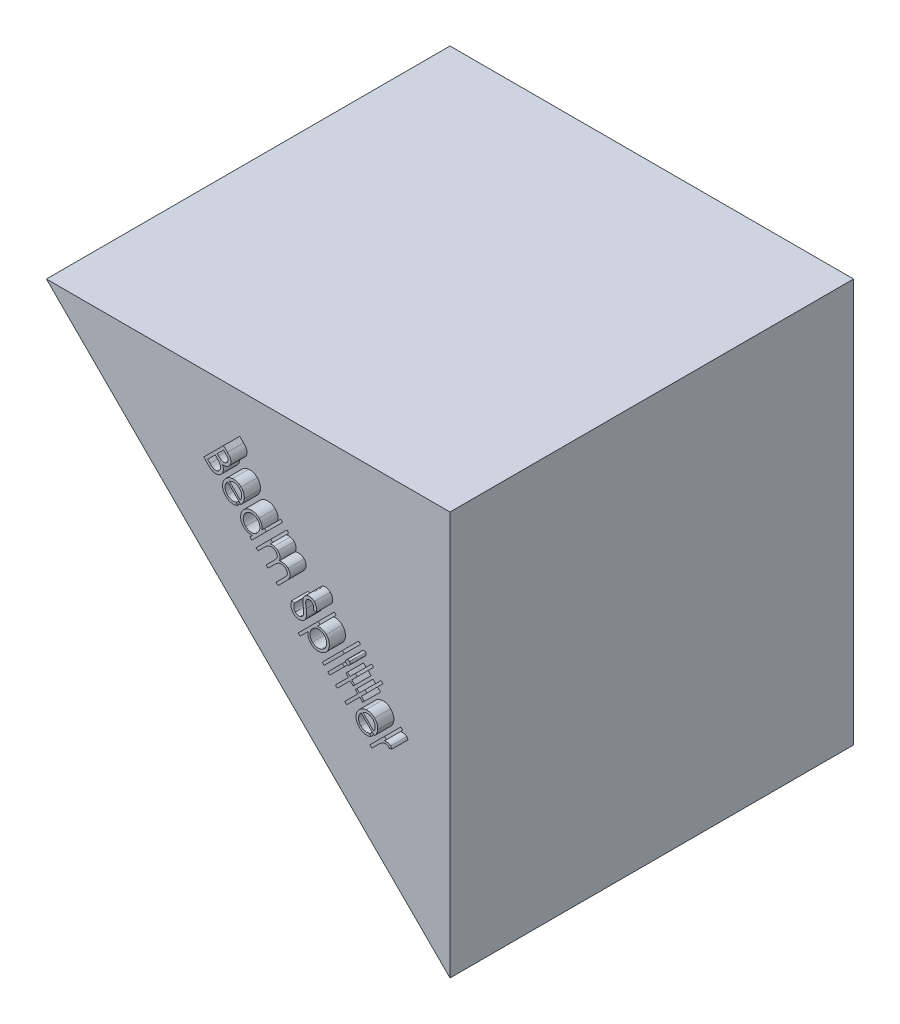
from build123d import *

# Parameters (mm, degrees)
BOSS_EXTRUDE1_DEPTH = 50
BOSS_EXTRUDE2_DEPTH = 2


with BuildPart() as part:
    # Sketch2 → Boss-Extrude1 (new body)
    with BuildSketch(Plane.XY):
        Polygon((-25, 25), (25, -25), (25, 25), align=None)
    extrude(amount=BOSS_EXTRUDE1_DEPTH)

    # Sketch4 → Boss-Extrude2 (add)
    # profile 1 of 13: a face of its own
    with BuildSketch(Plane.XY.offset(50)):
        with BuildLine():
            Line((18.890578005, -1.125044946), (19.128258294, -1.362725234))
            Line((19.128258294, -1.362725234), (18.863234255, -1.627749273))
            add(Edge.make_bspline(
                [(18.863234255, -1.627749273), (18.905664435, -1.620401977), (18.987348258, -1.606257442), (19.106904055, -1.59873747), (19.218017822, -1.60174019), (19.32096047, -1.61610099), (19.415681068, -1.642138184), (19.502125705, -1.678470317), (19.57996789, -1.726396122), (19.624294117, -1.766777124), (19.6463873, -1.78690392)],
                knots=[0, 0, 0, 0, 1.241211544, 2.389499754, 3.448301135, 4.442547987, 5.37958009, 6.273508928, 7.139478203, 8, 8, 8, 8], degree=3))
            add(Edge.make_bspline(
                [(19.6463873, -1.78690392), (19.662152608, -1.804220792), (19.694494667, -1.839745838), (19.733320617, -1.903409749), (19.766712399, -1.975665868), (19.783017204, -2.02809425), (19.791519512, -2.055433567)],
                knots=[0, 0, 0, 0, 0.909455834, 1.865721482, 2.887058557, 4, 4, 4, 4], degree=3))
            Line((19.791519512, -2.055433567), (19.473210217, -2.131154721))
            add(Edge.make_bspline(
                [(19.473210217, -2.131154721), (19.466555373, -2.114391022), (19.454029462, -2.082837977), (19.43088527, -2.040644022), (19.408766181, -2.004119642), (19.390560325, -1.984610033), (19.382064383, -1.975505683)],
                knots=[0, 0, 0, 0, 1.190511604, 2.240810163, 3.179056851, 4, 4, 4, 4], degree=3))
            add(Edge.make_bspline(
                [(19.382064383, -1.975505683), (19.361487844, -1.957252748), (19.319961236, -1.920415529), (19.242939965, -1.881688383), (19.155649222, -1.857054288), (19.076227397, -1.84678532), (19.008521153, -1.845645335), (18.954799236, -1.850077575), (18.8994629, -1.859217375), (18.842339218, -1.873512495), (18.783534201, -1.892441294), (18.72317027, -1.916450482), (18.661185703, -1.945349501), (18.620067076, -1.967575768), (18.598911339, -1.979011292)],
                knots=[0, 0, 0, 0, 1.174416853, 2.370153105, 3.65340849, 5.046895083, 5.787918235, 6.551267354, 7.35292589, 8.188329261, 9.071795005, 9.997759325, 10.969837261, 12, 12, 12, 12], degree=3))
            add(Edge.make_bspline(
                [(18.598911339, -1.979011292), (18.580750275, -1.989979104), (18.540648018, -2.014197621), (18.478853582, -2.059916247), (18.407558846, -2.115239723), (18.328756348, -2.183188785), (18.240427504, -2.261239246), (18.144509135, -2.351673329), (18.039270606, -2.452333636), (17.967075154, -2.524121443), (17.929340025, -2.561643503)],
                knots=[0, 0, 0, 0, 0.57221484, 1.263533197, 2.072177219, 3.007245432, 4.070389439, 5.252780822, 6.564083091, 8, 8, 8, 8], degree=3))
            Line((17.929340025, -2.561643503), (17.316559576, -3.174423952))
            Line((17.316559576, -3.174423952), (17.078879287, -2.936743664))
            Line((17.078879287, -2.936743664), (18.890578005, -1.125044946))
        make_face()
    # profile 2 of 13: a face of its own
    with BuildSketch(Plane.XY.offset(50)):
        with BuildLine():
            Line((17.071981385, -1.728123005), (17.165230584, -2.027502011))
            add(Edge.make_bspline(
                [(17.165230584, -2.027502011), (17.118711193, -2.041901978), (17.028205522, -2.069917795), (16.892426285, -2.096804509), (16.762286376, -2.112415759), (16.637048425, -2.113666211), (16.516149008, -2.103095526), (16.398812854, -2.081241325), (16.284241529, -2.048723912), (16.172453652, -2.005378834), (16.063575506, -1.94924204), (15.95722764, -1.880727317), (15.853365101, -1.799356685), (15.788421287, -1.737339845), (15.755274654, -1.705687107)],
                knots=[0, 0, 0, 0, 1.14337475, 2.224489593, 3.246783556, 4.218691023, 5.161197887, 6.093800951, 7.018450246, 7.955487584, 8.905814629, 9.891229908, 10.923706128, 12, 12, 12, 12], degree=3))
            add(Edge.make_bspline(
                [(15.755274654, -1.705687107), (15.720178574, -1.668943254), (15.651774541, -1.597327629), (15.563721244, -1.481286998), (15.49032384, -1.362527882), (15.431489228, -1.240745167), (15.388141362, -1.115610655), (15.360890775, -0.987234979), (15.348178663, -0.855993437), (15.350538838, -0.723172466), (15.366530019, -0.591989592), (15.391232176, -0.464457914), (15.427490786, -0.342615465), (15.47283715, -0.22574705), (15.529205319, -0.114431552), (15.596262482, -0.009095736), (15.672815108, 0.091288211), (15.730866366, 0.152781665), (15.760182507, 0.18383613)],
                knots=[0, 0, 0, 0, 1.153505557, 2.248240613, 3.301726212, 4.320405292, 5.314324999, 6.302485689, 7.294560466, 8.303383573, 9.313546827, 10.293286028, 11.250809265, 12.197244869, 13.137450858, 14.080066925, 15.030425349, 16, 16, 16, 16], degree=3))
            add(Edge.make_bspline(
                [(15.760182507, 0.18383613), (15.789132661, 0.211744951), (15.846272923, 0.266829886), (15.939881983, 0.338924884), (16.036925398, 0.403273981), (16.13837374, 0.458678652), (16.244264398, 0.504540357), (16.354384703, 0.540894595), (16.468474685, 0.569461985), (16.546715232, 0.580648431), (16.586103981, 0.58628004)],
                knots=[0, 0, 0, 0, 1.029832415, 2.03262798, 3.022679286, 4.011661158, 4.990782401, 5.975657052, 6.980882167, 8, 8, 8, 8], degree=3))
            add(Edge.make_bspline(
                [(16.586103981, 0.58628004), (16.636071744, 0.590935278), (16.734523258, 0.600107496), (16.880900802, 0.593871816), (17.022229831, 0.572596917), (17.158324054, 0.533438125), (17.288970421, 0.477640426), (17.414893157, 0.406099904), (17.535835833, 0.318104233), (17.609327633, 0.248280434), (17.646901257, 0.212582123)],
                knots=[0, 0, 0, 0, 1.030798262, 2.030982423, 3.003462981, 3.96313366, 4.934141121, 5.917529137, 6.935310111, 8, 8, 8, 8], degree=3))
            add(Edge.make_bspline(
                [(17.646901257, 0.212582123), (17.683551428, 0.173847359), (17.755283303, 0.09803551), (17.846008363, -0.026777432), (17.92122402, -0.155873212), (17.978321582, -0.290955458), (18.018797639, -0.43098807), (18.041627429, -0.576243315), (18.048591922, -0.726659124), (18.03933049, -0.827694237), (18.034621609, -0.879064511)],
                knots=[0, 0, 0, 0, 1.063807223, 2.082088108, 3.073002933, 4.041130971, 5.00261211, 5.976156965, 6.97099761, 8, 8, 8, 8], degree=3))
            add(Edge.make_bspline(
                [(18.034621609, -0.879064511), (18.029577594, -0.915913535), (18.019516078, -0.98941789), (17.990032367, -1.09719585), (17.953642266, -1.203468493), (17.904943099, -1.306948788), (17.847753351, -1.408756463), (17.779495203, -1.507859959), (17.70286847, -1.60570664), (17.644847644, -1.666876819), (17.615350776, -1.697974768)],
                knots=[0, 0, 0, 0, 0.951364535, 1.897728359, 2.855395875, 3.824641717, 4.821500491, 5.842285008, 6.90305193, 8, 8, 8, 8], degree=3))
            Line((17.615350776, -1.697974768), (15.986644846, -0.069268838))
            add(Edge.make_bspline(
                [(15.986644846, -0.069268838), (15.961863961, -0.096204935), (15.913337607, -0.148951658), (15.849850536, -0.233638437), (15.796685655, -0.320782415), (15.751811786, -0.409701231), (15.716651078, -0.501314216), (15.690614211, -0.595197421), (15.674244351, -0.691517019), (15.668313919, -0.789013114), (15.670902517, -0.885959786), (15.682749984, -0.980409179), (15.703977654, -1.07154383), (15.734004569, -1.159299754), (15.773742222, -1.24371479), (15.823031069, -1.324005729), (15.880869655, -1.401633939), (15.925830338, -1.448823052), (15.94878427, -1.472914671)],
                knots=[0, 0, 0, 0, 1.121678263, 2.196489528, 3.238606981, 4.248014423, 5.246040331, 6.242135197, 7.230468167, 8.23569606, 9.232100145, 10.199960908, 11.148965087, 12.096155113, 13.038535726, 14.003208359, 14.98057112, 16, 16, 16, 16], degree=3))
            add(Edge.make_bspline(
                [(15.94878427, -1.472914671), (15.972155339, -1.495428804), (16.018744531, -1.54030973), (16.096856023, -1.597781881), (16.178296297, -1.650571334), (16.264790169, -1.694672248), (16.352862618, -1.731650882), (16.441003399, -1.760179556), (16.528407522, -1.779017342), (16.617532897, -1.790396288), (16.713544707, -1.790838524), (16.820701988, -1.778702635), (16.942231129, -1.759743552), (17.02701231, -1.73908211), (17.071981385, -1.728123005)],
                knots=[0, 0, 0, 0, 0.960880005, 1.915471739, 2.868629679, 3.835285571, 4.788594539, 5.697766926, 6.576884551, 7.435260203, 8.356622716, 9.414693406, 10.628718719, 12, 12, 12, 12], degree=3))
        make_face()
        with BuildLine():
            add(Edge.make_bspline(
                [(17.559962154, -1.240142236), (17.581837284, -1.202477795), (17.623921088, -1.130018208), (17.671231049, -1.018418385), (17.706241003, -0.911675525), (17.724714732, -0.807102009), (17.729639265, -0.703932789), (17.721745967, -0.600115797), (17.700946624, -0.494811343), (17.668126369, -0.389368468), (17.624384162, -0.286002577), (17.569443962, -0.188164125), (17.504042505, -0.096641734), (17.452642633, -0.042071889), (17.426749013, -0.014581338)],
                knots=[0, 0, 0, 0, 1.169762225, 2.250411434, 3.251822014, 4.18348598, 5.095497708, 6.021595392, 6.975241018, 7.974777718, 8.98531032, 9.986661778, 10.985744273, 12, 12, 12, 12], degree=3))
            add(Edge.make_bspline(
                [(17.426749013, -0.014581338), (17.404518993, 0.006962693), (17.360716834, 0.049413172), (17.288321921, 0.103434425), (17.214841059, 0.152208436), (17.136869921, 0.191286044), (17.056469774, 0.223568087), (16.973033468, 0.248583378), (16.886464546, 0.264564648), (16.827579929, 0.269622981), (16.797842763, 0.272177476)],
                knots=[0, 0, 0, 0, 1.049137773, 2.067226999, 3.059075058, 4.037747443, 5.019786334, 5.995660531, 6.987793763, 8, 8, 8, 8], degree=3))
            add(Edge.make_bspline(
                [(16.797842763, 0.272177476), (16.775402521, 0.272789552), (16.729997414, 0.274028015), (16.660771645, 0.268824854), (16.589961711, 0.257560809), (16.51732966, 0.239801445), (16.443041463, 0.215592067), (16.36654386, 0.18632018), (16.288727107, 0.150389291), (16.237277064, 0.12286932), (16.211003821, 0.108816098)],
                knots=[0, 0, 0, 0, 0.872509664, 1.76541744, 2.694766804, 3.658024887, 4.669711852, 5.731315059, 6.841483737, 8, 8, 8, 8], degree=3))
            Line((16.211003821, 0.108816098), (17.559962154, -1.240142236))
        make_face(mode=Mode.SUBTRACT)
    # profile 3 of 13: a face of its own
    with BuildSketch(Plane.XY.offset(50)):
        Polygon((16.459601376, 2.652085529), (16.694477178, 2.417209728), (16.021400255, 1.744132805), (16.39089144, 1.374641619), (16.191071729, 1.174821908), (15.821580543, 1.544313093), (14.209701537, -0.067565913), (13.974825735, 0.167309888), (15.586704742, 1.779188895), (15.269096569, 2.096797068), (15.46891628, 2.296616779), (15.786524453, 1.979008606), align=None)
    # profile 4 of 13: a face of its own
    with BuildSketch(Plane.XY.offset(50)):
        Polygon((15.28562281, 3.826064096), (15.520498611, 3.591188294), (14.847421688, 2.918111371), (15.216912874, 2.548620185), (15.017093163, 2.348800474), (14.647601977, 2.71829166), (13.03572297, 1.106412653), (12.800847169, 1.341288455), (14.412726176, 2.953167461), (14.095118002, 3.270775634), (14.294937714, 3.470595346), (14.612545887, 3.152987173), align=None)
    # profile 5 of 13: a face of its own
    with BuildSketch(Plane.XY.offset(50)):
        with BuildLine():
            add(Edge.make_bspline(
                [(14.539204097, 4.718316142), (14.551486086, 4.704743497), (14.575590453, 4.678106114), (14.60111387, 4.630894067), (14.616201171, 4.579537319), (14.620638485, 4.525507649), (14.616201171, 4.471477979), (14.60111387, 4.420121231), (14.575590453, 4.372909183), (14.551486086, 4.346271801), (14.539204097, 4.332699155)],
                knots=[0, 0, 0, 0, 1.022162629, 2.006074404, 2.975076234, 4, 5.024923766, 5.993925596, 6.977837371, 8, 8, 8, 8], degree=3))
            add(Edge.make_bspline(
                [(14.539204097, 4.332699155), (14.52587289, 4.320621082), (14.499709363, 4.296916925), (14.452528346, 4.272215248), (14.401469576, 4.256232624), (14.347108857, 4.252094592), (14.292900616, 4.256100262), (14.242048575, 4.272553738), (14.194288612, 4.296824646), (14.167817809, 4.321029073), (14.154288231, 4.333400277)],
                knots=[0, 0, 0, 0, 1.006534559, 1.975402156, 2.963457113, 3.991243031, 5.019028948, 5.994540287, 6.97498293, 8, 8, 8, 8], degree=3))
            add(Edge.make_bspline(
                [(14.154288231, 4.333400277), (14.142230886, 4.346737502), (14.118567412, 4.37291284), (14.093599115, 4.419947576), (14.078841793, 4.47104628), (14.07426727, 4.525017552), (14.078557712, 4.57918829), (14.094496507, 4.630235865), (14.11920944, 4.677419757), (14.142912062, 4.703582892), (14.154989353, 4.716913899)],
                knots=[0, 0, 0, 0, 1.010873706, 1.983918069, 2.97246127, 3.991550813, 5.023767492, 6.016081931, 6.989126294, 8, 8, 8, 8], degree=3))
            add(Edge.make_bspline(
                [(14.154989353, 4.716913899), (14.16856196, 4.729195563), (14.195199267, 4.753299293), (14.242411862, 4.778827331), (14.293766536, 4.79389714), (14.347571055, 4.798383841), (14.401562156, 4.793750539), (14.452655749, 4.779008368), (14.499691806, 4.754036154), (14.525866964, 4.730373215), (14.539204097, 4.718316142)],
                knots=[0, 0, 0, 0, 1.026867049, 2.015307197, 2.988768778, 4.018409672, 5.034956187, 6.021032585, 6.991648821, 8, 8, 8, 8], degree=3))
        make_face()
    # profile 6 of 13: a face of its own
    with BuildSketch(Plane.XY.offset(50)):
        Polygon((13.676824289, 4.088708771), (13.91170009, 3.853832969), (12.100001372, 2.042134251), (11.865125571, 2.277010053), align=None)
    # profile 7 of 13: a face of its own
    with BuildSketch(Plane.XY.offset(50)):
        Polygon((13.678502531, 5.486469632), (13.911274967, 5.253697196), (11.399856697, 2.742278926), (11.167084261, 2.975051362), align=None)
    # profile 8 of 13: a face of its own
    with BuildSketch(Plane.XY.offset(50)):
        with BuildLine():
            Line((10.668686424, 7.096846636), (10.900056616, 6.865476443))
            Line((10.900056616, 6.865476443), (10.567023764, 6.532443591))
            add(Edge.make_bspline(
                [(10.567023764, 6.532443591), (10.620681884, 6.539122605), (10.725388527, 6.552155809), (10.880753165, 6.553344849), (11.029089772, 6.535213059), (11.17120582, 6.502200965), (11.30600044, 6.449918492), (11.434926946, 6.382528864), (11.556190061, 6.296372157), (11.629279818, 6.227873141), (11.666382738, 6.193100642)],
                knots=[0, 0, 0, 0, 1.083185549, 2.11369165, 3.104292222, 4.072264151, 5.030039122, 5.993865542, 6.981615906, 8, 8, 8, 8], degree=3))
            add(Edge.make_bspline(
                [(11.666382738, 6.193100642), (11.697202238, 6.160734497), (11.758082117, 6.096799422), (11.836805334, 5.99167801), (11.902720604, 5.881208495), (11.957548942, 5.765890729), (11.999511696, 5.645275468), (12.02900851, 5.519301961), (12.046670257, 5.388295519), (12.051068225, 5.25354174), (12.044349234, 5.118871565), (12.025734262, 4.987480584), (11.993636918, 4.861590656), (11.951080358, 4.740096806), (11.895286085, 4.623758125), (11.826778019, 4.513118713), (11.747455037, 4.406564592), (11.685791002, 4.341991572), (11.654463667, 4.309186379)],
                knots=[0, 0, 0, 0, 1.023687358, 2.02216012, 3.002361287, 3.968008255, 4.943793914, 5.923453385, 6.928742326, 7.968601011, 9.009163092, 10.015935139, 11.004603497, 11.982166559, 12.962089595, 13.95520286, 14.961176584, 16, 16, 16, 16], degree=3))
            add(Edge.make_bspline(
                [(11.654463667, 4.309186379), (11.620924866, 4.27720339), (11.555026018, 4.214361488), (11.447278433, 4.132598308), (11.335141714, 4.062926245), (11.217847165, 4.005792198), (11.096272938, 3.960613431), (10.969572471, 3.928337959), (10.838339607, 3.907898082), (10.70381587, 3.90070772), (10.569789572, 3.904397055), (10.439158342, 3.921212028), (10.313974545, 3.95074404), (10.19393461, 3.992362879), (10.079082191, 4.045988904), (9.969188144, 4.111440159), (9.864480307, 4.189628871), (9.800802135, 4.250308851), (9.768446039, 4.281141508)],
                knots=[0, 0, 0, 0, 1.058993912, 2.080768382, 3.086216623, 4.073262574, 5.058976791, 6.046601197, 7.057840905, 8.090872257, 9.122728099, 10.119619421, 11.096939972, 12.058545789, 13.019616919, 13.990149676, 14.978756678, 16, 16, 16, 16], degree=3))
            add(Edge.make_bspline(
                [(9.768446039, 4.281141508), (9.734083686, 4.317511178), (9.666191493, 4.389369376), (9.581924244, 4.50957601), (9.51121027, 4.635365698), (9.457050564, 4.768451034), (9.419340066, 4.908647495), (9.395986896, 5.055012994), (9.389030542, 5.208351758), (9.39606125, 5.312053974), (9.399655975, 5.365075802)],
                knots=[0, 0, 0, 0, 1.011926893, 1.999337382, 2.963153277, 3.928883982, 4.900048302, 5.896623414, 6.924566155, 8, 8, 8, 8], degree=3))
            Line((9.399655975, 5.365075802), (8.425797802, 4.391217629))
            Line((8.425797802, 4.391217629), (8.19442761, 4.622587822))
            Line((8.19442761, 4.622587822), (10.668686424, 7.096846636))
        make_face()
        with BuildLine():
            add(Edge.make_bspline(
                [(11.423093475, 5.986269713), (11.397536019, 6.010302888), (11.347318, 6.057525837), (11.266453972, 6.120033673), (11.180675564, 6.170908158), (11.092520766, 6.21454345), (10.999569265, 6.246607477), (10.903580673, 6.269872079), (10.803711575, 6.283302881), (10.701606017, 6.286253849), (10.599144561, 6.281434888), (10.498991693, 6.264671236), (10.401849674, 6.239735906), (10.308053816, 6.204468416), (10.217991857, 6.158959786), (10.130404471, 6.105026055), (10.046819595, 6.040019322), (9.994751295, 5.990915027), (9.968265751, 5.965937181)],
                knots=[0, 0, 0, 0, 1.036646365, 2.036913527, 3.013062686, 3.980052609, 4.939115033, 5.912523019, 6.89529748, 7.911301824, 8.92822154, 9.921883995, 10.907034596, 11.888521605, 12.877056782, 13.885306063, 14.924320175, 16, 16, 16, 16], degree=3))
            add(Edge.make_bspline(
                [(9.968265751, 5.965937181), (9.935479923, 5.93124469), (9.871259361, 5.863289376), (9.793321582, 5.748624938), (9.730711687, 5.628839267), (9.685666916, 5.503128521), (9.658885992, 5.373541779), (9.650427165, 5.241636837), (9.660325462, 5.108047021), (9.689399837, 4.97502969), (9.734372025, 4.846390532), (9.794922427, 4.725748868), (9.86866202, 4.613859926), (9.929438075, 4.548650246), (9.959852289, 4.516017309)],
                knots=[0, 0, 0, 0, 1.060829248, 2.077942044, 3.073577278, 4.062300803, 5.03950691, 6.008930819, 6.994640103, 8.010688473, 9.03056358, 10.019122929, 11.008707932, 12, 12, 12, 12], degree=3))
            add(Edge.make_bspline(
                [(9.959852289, 4.516017309), (9.992033638, 4.486316757), (10.055984656, 4.427295597), (10.165558805, 4.355766031), (10.283748943, 4.298296821), (10.410119096, 4.256617251), (10.54206825, 4.231006767), (10.676508868, 4.224347721), (10.812401793, 4.234664489), (10.947115402, 4.264709408), (11.078101394, 4.309320655), (11.200168768, 4.370272088), (11.312687272, 4.444658188), (11.378283498, 4.505261389), (11.411174405, 4.535648719)],
                knots=[0, 0, 0, 0, 0.978521325, 1.944524937, 2.915188779, 3.912411463, 4.913452708, 5.913687659, 6.915630091, 7.953689836, 8.993973496, 10.00432885, 10.999341322, 12, 12, 12, 12], degree=3))
            add(Edge.make_bspline(
                [(11.411174405, 4.535648719), (11.442128095, 4.568698423), (11.50366421, 4.634401425), (11.577493283, 4.747866264), (11.638942193, 4.869049344), (11.682826921, 4.999039303), (11.71206003, 5.132615374), (11.722434, 5.267254601), (11.71607285, 5.400660763), (11.689147892, 5.531221058), (11.647676625, 5.657607628), (11.588951754, 5.776570215), (11.514892005, 5.88791155), (11.45397876, 5.953177463), (11.423093475, 5.986269713)],
                knots=[0, 0, 0, 0, 1.009635128, 2.007160496, 3.01098977, 4.037792448, 5.062642737, 6.057542242, 7.045515651, 8.035472889, 9.025911708, 10.008755554, 10.990364872, 12, 12, 12, 12], degree=3))
        make_face(mode=Mode.SUBTRACT)
    # profile 9 of 13: a face of its own
    with BuildSketch(Plane.XY.offset(50)):
        with BuildLine():
            Line((7.381994993, 7.673001208), (7.715027845, 7.589567714))
            add(Edge.make_bspline(
                [(7.715027845, 7.589567714), (7.701278549, 7.53952679), (7.674960449, 7.443741377), (7.65124976, 7.302635925), (7.640198894, 7.172088217), (7.645525196, 7.051642242), (7.6653842, 6.941610915), (7.70074081, 6.842134094), (7.7504518, 6.752282776), (7.795564367, 6.702345841), (7.818092749, 6.677408259)],
                knots=[0, 0, 0, 0, 1.291176079, 2.471493815, 3.556724466, 4.546898705, 5.46435486, 6.329279941, 7.165673282, 8, 8, 8, 8], degree=3))
            add(Edge.make_bspline(
                [(7.818092749, 6.677408259), (7.839092362, 6.657635934), (7.880557313, 6.618594333), (7.951377016, 6.57082359), (8.026522685, 6.531287306), (8.106094715, 6.501225311), (8.187593121, 6.481690364), (8.268964148, 6.472661221), (8.348732154, 6.47659935), (8.426183242, 6.490363352), (8.499600351, 6.515093566), (8.568246603, 6.548472685), (8.632129774, 6.589418749), (8.669026871, 6.623767681), (8.687483775, 6.640949926)],
                knots=[0, 0, 0, 0, 1.07119194, 2.115130436, 3.164842574, 4.223869745, 5.269543681, 6.274544611, 7.257695498, 8.229484564, 9.191506659, 10.128383898, 11.063768104, 12, 12, 12, 12], degree=3))
            add(Edge.make_bspline(
                [(8.687483775, 6.640949926), (8.707002995, 6.662532501), (8.746252257, 6.705930757), (8.791041169, 6.783837721), (8.826009035, 6.870418529), (8.839172974, 6.932808789), (8.8459373, 6.964868195)],
                knots=[0, 0, 0, 0, 0.951552025, 1.913381446, 2.927785344, 4, 4, 4, 4], degree=3))
            add(Edge.make_bspline(
                [(8.8459373, 6.964868195), (8.849496649, 6.989374731), (8.856965451, 7.040798311), (8.862752722, 7.122530285), (8.865652013, 7.212109506), (8.86403562, 7.309894218), (8.858088041, 7.415549654), (8.84913553, 7.52920821), (8.835500599, 7.650719594), (8.82435809, 7.734252757), (8.81859355, 7.777468356)],
                knots=[0, 0, 0, 0, 0.728237508, 1.528105792, 2.408504073, 3.364194011, 4.403737984, 5.52102854, 6.71751255, 8, 8, 8, 8], degree=3))
            add(Edge.make_bspline(
                [(8.81859355, 7.777468356), (8.812898343, 7.820459333), (8.802010432, 7.90264808), (8.78778724, 8.020398907), (8.777096885, 8.126982874), (8.770165889, 8.222150119), (8.765754197, 8.30607439), (8.764097672, 8.378552015), (8.765483085, 8.440211648), (8.770184234, 8.477210035), (8.772319512, 8.49401483)],
                knots=[0, 0, 0, 0, 1.446124113, 2.764652865, 3.954996913, 5.017754494, 5.946341782, 6.757000529, 7.435425373, 8, 8, 8, 8], degree=3))
            add(Edge.make_bspline(
                [(8.772319512, 8.49401483), (8.776365267, 8.518867606), (8.784329174, 8.567789303), (8.802947928, 8.638980776), (8.825878744, 8.707051675), (8.854048667, 8.771765993), (8.887088602, 8.833406376), (8.926075972, 8.891259068), (8.968421335, 8.947238216), (9.000777362, 8.981121493), (9.017011018, 8.9981214)],
                knots=[0, 0, 0, 0, 1.058992889, 2.084585255, 3.092151245, 4.078670416, 5.051071046, 6.030210775, 7.011717962, 8, 8, 8, 8], degree=3))
            add(Edge.make_bspline(
                [(9.017011018, 8.9981214), (9.043931158, 9.023456194), (9.096991897, 9.073392149), (9.187283213, 9.133858218), (9.283225858, 9.181356988), (9.384547952, 9.214707608), (9.488857555, 9.235740958), (9.595333906, 9.240016424), (9.70255434, 9.231468064), (9.808866461, 9.205810594), (9.913268004, 9.169665227), (10.011551601, 9.118364095), (10.104449496, 9.055916134), (10.158874598, 9.004547265), (10.186482172, 8.97848999)],
                knots=[0, 0, 0, 0, 1.018758265, 2.008015852, 2.985853666, 3.964860698, 4.94391022, 5.91242938, 6.896374234, 7.902394438, 8.922397369, 9.937781271, 10.953922823, 12, 12, 12, 12], degree=3))
            add(Edge.make_bspline(
                [(10.186482172, 8.97848999), (10.214033884, 8.949083087), (10.268706303, 8.890729307), (10.334437783, 8.790320137), (10.387413837, 8.682992186), (10.420776546, 8.587280088), (10.439110006, 8.505402044), (10.449756954, 8.438689065), (10.455662203, 8.366751881), (10.458595436, 8.290010577), (10.456977243, 8.208104987), (10.451250857, 8.121093227), (10.441367563, 8.028976381), (10.432307409, 7.966043769), (10.427668069, 7.933818516)],
                knots=[0, 0, 0, 0, 1.295470664, 2.570675635, 3.846147014, 5.14310301, 5.822196153, 6.545934075, 7.316473173, 8.144777815, 9.017815504, 9.952863946, 10.95174417, 12, 12, 12, 12], degree=3))
            Line((10.427668069, 7.933818516), (10.07640605, 7.98219592))
            add(Edge.make_bspline(
                [(10.07640605, 7.98219592), (10.079737097, 8.008128171), (10.086152259, 8.058070302), (10.094479364, 8.1304564), (10.098201395, 8.197869193), (10.100819322, 8.260058333), (10.099794569, 8.317122575), (10.097688204, 8.369172019), (10.091151535, 8.415969281), (10.080087937, 8.471223538), (10.060146007, 8.534895658), (10.025970753, 8.605819066), (9.982353959, 8.671760932), (9.946554376, 8.710648088), (9.928469352, 8.730292875)],
                knots=[0, 0, 0, 0, 1.184266723, 2.280743053, 3.298905822, 4.241524397, 5.098991591, 5.883440502, 6.599019358, 7.23633328, 8.434848111, 9.60899535, 10.792126177, 12, 12, 12, 12], degree=3))
            add(Edge.make_bspline(
                [(9.928469352, 8.730292875), (9.903799252, 8.753081154), (9.856064435, 8.797174788), (9.77288109, 8.844449733), (9.686018363, 8.875396913), (9.596058636, 8.884971343), (9.507707437, 8.879316092), (9.423725773, 8.855807732), (9.3460493, 8.814402456), (9.302316895, 8.775000649), (9.279931691, 8.754832138)],
                knots=[0, 0, 0, 0, 1.108390795, 2.144654212, 3.142766654, 4.139709309, 5.116888158, 6.0572744, 7.005581559, 8, 8, 8, 8], degree=3))
            add(Edge.make_bspline(
                [(9.279931691, 8.754832138), (9.266896791, 8.741387023), (9.240884171, 8.714555772), (9.20930386, 8.668160634), (9.180492732, 8.619615276), (9.157260141, 8.56618618), (9.138504934, 8.506865737), (9.12650899, 8.439495028), (9.118811659, 8.363785699), (9.117801787, 8.310342621), (9.117271435, 8.282276048)],
                knots=[0, 0, 0, 0, 0.872206552, 1.740587019, 2.610335877, 3.503892006, 4.452388294, 5.506808572, 6.690656621, 8, 8, 8, 8], degree=3))
            add(Edge.make_bspline(
                [(9.117271435, 8.282276048), (9.11766627, 8.272455717), (9.118617112, 8.248806379), (9.122479576, 8.207681657), (9.127924084, 8.154811244), (9.136849409, 8.090657753), (9.146422741, 8.014643361), (9.158185532, 7.927176038), (9.173424477, 7.828226406), (9.183475716, 7.758313894), (9.188785858, 7.721378612)],
                knots=[0, 0, 0, 0, 0.416963678, 1.004132585, 1.752086881, 2.672130089, 3.75206962, 5.003039264, 6.416684121, 8, 8, 8, 8], degree=3))
            add(Edge.make_bspline(
                [(9.188785858, 7.721378612), (9.195065541, 7.676534109), (9.207215081, 7.589771754), (9.221543059, 7.463333304), (9.23052287, 7.344751371), (9.235809404, 7.233926892), (9.236020387, 7.130731741), (9.231054004, 7.035512627), (9.222454602, 6.948081529), (9.203813155, 6.843978852), (9.171127616, 6.724972971), (9.116056636, 6.59492175), (9.04638003, 6.478570206), (8.986825101, 6.413143017), (8.957415666, 6.38083374)],
                knots=[0, 0, 0, 0, 1.154073635, 2.232829841, 3.242441131, 4.184480987, 5.060076888, 5.871224333, 6.613870166, 7.297408356, 8.56479994, 9.749711327, 10.888761692, 12, 12, 12, 12], degree=3))
            add(Edge.make_bspline(
                [(8.957415666, 6.38083374), (8.934927306, 6.359558024), (8.890456735, 6.317485449), (8.81713282, 6.263254595), (8.739367618, 6.218586389), (8.658377089, 6.180410506), (8.572372829, 6.153145621), (8.482703672, 6.13204113), (8.388625686, 6.121400699), (8.29176829, 6.118676088), (8.194574221, 6.123945689), (8.099414179, 6.13861653), (8.007931334, 6.162731358), (7.919673915, 6.194912012), (7.834992519, 6.236787674), (7.753787392, 6.287287181), (7.675736044, 6.346615092), (7.627909977, 6.392047458), (7.60354948, 6.415188708)],
                knots=[0, 0, 0, 0, 0.987419472, 1.952614886, 2.901856038, 3.846337881, 4.803981627, 5.775639995, 6.782227406, 7.819438665, 8.865383083, 9.88443968, 10.886706716, 11.880192648, 12.877590837, 13.895937461, 14.928283006, 16, 16, 16, 16], degree=3))
            add(Edge.make_bspline(
                [(7.60354948, 6.415188708), (7.585494675, 6.433855291), (7.549643756, 6.470920998), (7.501332752, 6.530868763), (7.457931937, 6.592928458), (7.419849701, 6.657548852), (7.385797292, 6.723965134), (7.35804605, 6.793617027), (7.334828701, 6.865283739), (7.316312193, 6.939463257), (7.303540768, 7.017045751), (7.297588708, 7.098672234), (7.297009293, 7.184380493), (7.301846878, 7.274330681), (7.313465081, 7.368369641), (7.330353188, 7.466387877), (7.352750919, 7.568716106), (7.372058816, 7.637568551), (7.381994993, 7.673001208)],
                knots=[0, 0, 0, 0, 0.923509253, 1.833786328, 2.735632435, 3.615439222, 4.500416779, 5.388202063, 6.279562127, 7.178951928, 8.105711734, 9.073093024, 10.087496873, 11.153343944, 12.275401901, 13.456413066, 14.691026271, 16, 16, 16, 16], degree=3))
        make_face()
    # profile 10 of 13: a face of its own
    with BuildSketch(Plane.XY.offset(50)):
        with BuildLine():
            Line((4.79388574, 12.971647319), (5.025255933, 12.740277127))
            Line((5.025255933, 12.740277127), (4.712555612, 12.427576806))
            add(Edge.make_bspline(
                [(4.712555612, 12.427576806), (4.759905069, 12.434978702), (4.850524659, 12.449144794), (4.982402155, 12.455961531), (5.103705938, 12.452004447), (5.179617702, 12.437381937), (5.215961061, 12.430381294)],
                knots=[0, 0, 0, 0, 1.134473677, 2.171208445, 3.124451552, 4, 4, 4, 4], degree=3))
            add(Edge.make_bspline(
                [(5.215961061, 12.430381294), (5.261756847, 12.417388421), (5.351780167, 12.391847611), (5.477428084, 12.332256139), (5.593265291, 12.258764653), (5.659931545, 12.197059403), (5.693425003, 12.166058377)],
                knots=[0, 0, 0, 0, 1.032654138, 2.029945562, 3.010234824, 4, 4, 4, 4], degree=3))
            add(Edge.make_bspline(
                [(5.693425003, 12.166058377), (5.7144928, 12.143819732), (5.756505828, 12.099471818), (5.810210476, 12.025703813), (5.855498144, 11.947053844), (5.892114203, 11.864900595), (5.921111965, 11.781263906), (5.940189862, 11.697562159), (5.949535659, 11.615000223), (5.948906241, 11.532343935), (5.937226617, 11.446827944), (5.913061499, 11.356231699), (5.879023501, 11.258282627), (5.847876975, 11.192852938), (5.831545997, 11.158546358)],
                knots=[0, 0, 0, 0, 1.00533737, 2.004826032, 2.988358455, 3.981311445, 4.95472706, 5.891402496, 6.795035451, 7.67782268, 8.599500702, 9.621607202, 10.752943411, 12, 12, 12, 12], degree=3))
            add(Edge.make_bspline(
                [(5.831545997, 11.158546358), (5.858819348, 11.166059648), (5.912343443, 11.180804519), (5.992788063, 11.198043182), (6.071823065, 11.208669277), (6.149456, 11.216429525), (6.225841102, 11.217413081), (6.300857679, 11.214414631), (6.374292319, 11.20467613), (6.469760657, 11.187526386), (6.584274698, 11.153729777), (6.712806893, 11.09550584), (6.831709581, 11.02074447), (6.900049929, 10.95708165), (6.93441058, 10.9250728)],
                knots=[0, 0, 0, 0, 0.859045316, 1.685880955, 2.495883023, 3.279812829, 4.053556047, 4.813802993, 5.557673419, 6.301035794, 7.758555751, 9.168861684, 10.576539933, 12, 12, 12, 12], degree=3))
            add(Edge.make_bspline(
                [(6.93441058, 10.9250728), (6.963882665, 10.893373635), (7.02142026, 10.831488169), (7.090257755, 10.726709743), (7.14142995, 10.615627002), (7.174192545, 10.498689875), (7.190015962, 10.378925034), (7.186406233, 10.257729589), (7.163242164, 10.136887612), (7.129224821, 10.036600975), (7.091444545, 9.95526987), (7.054536992, 9.8909426), (7.010794327, 9.823292587), (6.95937738, 9.75251615), (6.900491634, 9.678517243), (6.834466527, 9.601205464), (6.760565194, 9.521214414), (6.7078704, 9.467757232), (6.68060449, 9.440096839)],
                knots=[0, 0, 0, 0, 1.209733365, 2.361731451, 3.491510003, 4.620000237, 5.74773195, 6.860184626, 7.998113719, 9.179214519, 9.814231796, 10.505477689, 11.252986731, 12.068123698, 12.952781798, 13.899218811, 14.912991071, 16, 16, 16, 16], degree=3))
            Line((6.68060449, 9.440096839), (5.691321638, 8.450813986))
            Line((5.691321638, 8.450813986), (5.453641349, 8.688494274))
            Line((5.453641349, 8.688494274), (6.442924202, 9.677777127))
            add(Edge.make_bspline(
                [(6.442924202, 9.677777127), (6.466122923, 9.701319861), (6.510555334, 9.746411158), (6.573302811, 9.81205115), (6.627995235, 9.874206904), (6.676605092, 9.931357174), (6.717855547, 9.984570488), (6.752632932, 10.032972623), (6.780301285, 10.077108464), (6.807393546, 10.12997769), (6.83024335, 10.195265654), (6.846561628, 10.274596214), (6.84709398, 10.356360311), (6.836718971, 10.438741873), (6.814010729, 10.521308913), (6.775458286, 10.600272539), (6.726009656, 10.677300284), (6.683052811, 10.722402945), (6.66097308, 10.745585621)],
                knots=[0, 0, 0, 0, 1.264308701, 2.421525023, 3.47275104, 4.430787231, 5.290892379, 6.047435303, 6.709808252, 7.281521255, 8.316428011, 9.345565774, 10.364833074, 11.42819055, 12.514927032, 13.622603783, 14.778023183, 16, 16, 16, 16], degree=3))
            add(Edge.make_bspline(
                [(6.66097308, 10.745585621), (6.632147761, 10.772391972), (6.575133673, 10.825412707), (6.474614908, 10.885566288), (6.36648438, 10.931503655), (6.250247445, 10.958367513), (6.1309415, 10.971050596), (6.011057003, 10.964383174), (5.892522273, 10.940101959), (5.794621422, 10.904994319), (5.715150977, 10.864829305), (5.649540117, 10.826103183), (5.57991585, 10.777227394), (5.504641564, 10.720136187), (5.424130916, 10.654515612), (5.339634787, 10.578747377), (5.248655149, 10.495856472), (5.188367312, 10.435483822), (5.15706683, 10.404139306)],
                knots=[0, 0, 0, 0, 1.07879147, 2.133759908, 3.19862743, 4.294988807, 5.398359592, 6.485013952, 7.579286357, 8.712627368, 9.329994089, 10.023738666, 10.80383394, 11.665515132, 12.619194427, 13.656309143, 14.783193149, 16, 16, 16, 16], degree=3))
            Line((5.15706683, 10.404139306), (4.447531574, 9.69460405))
            Line((4.447531574, 9.69460405), (4.216161381, 9.925974242))
            Line((4.216161381, 9.925974242), (5.143745516, 10.853558377))
            add(Edge.make_bspline(
                [(5.143745516, 10.853558377), (5.169763874, 10.879892233), (5.219832037, 10.930567522), (5.290420598, 11.004447533), (5.352993862, 11.073049921), (5.40722799, 11.136614967), (5.454237872, 11.194230373), (5.493191147, 11.247049189), (5.524152504, 11.29454661), (5.555199228, 11.350125845), (5.581404541, 11.418252458), (5.601530947, 11.500789292), (5.604797001, 11.58570315), (5.596973769, 11.671159975), (5.574071905, 11.755600308), (5.538222329, 11.837025823), (5.487452291, 11.913848029), (5.445211543, 11.959561585), (5.423493112, 11.983065589)],
                knots=[0, 0, 0, 0, 1.330253238, 2.559859307, 3.671624332, 4.666336319, 5.56214849, 6.34322225, 7.023421132, 7.598495632, 8.627775355, 9.636183871, 10.636834068, 11.666353592, 12.709349255, 13.765849434, 14.851292963, 16, 16, 16, 16], degree=3))
            add(Edge.make_bspline(
                [(5.423493112, 11.983065589), (5.395694755, 12.008270037), (5.340325579, 12.058472628), (5.243995568, 12.118056741), (5.137700302, 12.161366608), (5.023900084, 12.189895939), (4.905912347, 12.202423139), (4.786539817, 12.198598403), (4.668042238, 12.175495443), (4.570328967, 12.14200921), (4.491414732, 12.104846125), (4.428275274, 12.068776403), (4.361937235, 12.024946566), (4.291423488, 11.974678395), (4.218972108, 11.91521686), (4.14254457, 11.849278363), (4.062146503, 11.776312864), (4.00889674, 11.723626039), (3.98128558, 11.696306774)],
                knots=[0, 0, 0, 0, 1.083894396, 2.158916845, 3.256307527, 4.392703367, 5.541800114, 6.678397068, 7.834691665, 9.021364541, 9.656516682, 10.355927896, 11.122923385, 11.956054792, 12.859926905, 13.833085992, 14.876407946, 16, 16, 16, 16], degree=3))
            Line((3.98128558, 11.696306774), (3.213557215, 10.928578409))
            Line((3.213557215, 10.928578409), (2.982187022, 11.159948601))
            Line((2.982187022, 11.159948601), (4.79388574, 12.971647319))
        make_face()
    # profile 11 of 13: a face of its own
    with BuildSketch(Plane.XY.offset(50)):
        with BuildLine():
            Line((4.252719473, 13.512813586), (2.441020755, 11.701114868))
            Line((2.441020755, 11.701114868), (2.211052807, 11.931082817))
            Line((2.211052807, 11.931082817), (2.522350884, 12.242380894))
            add(Edge.make_bspline(
                [(2.522350884, 12.242380894), (2.469328066, 12.238782256), (2.365623917, 12.231743895), (2.212299026, 12.23875515), (2.065599016, 12.261954414), (1.925316582, 12.300506754), (1.791830022, 12.354822267), (1.665330158, 12.425048966), (1.54547466, 12.510415629), (1.473428856, 12.578274776), (1.437014345, 12.612573202)],
                knots=[0, 0, 0, 0, 1.073728533, 2.100041269, 3.095036115, 4.070467267, 5.034666616, 6.001085814, 6.989677717, 8, 8, 8, 8], degree=3))
            add(Edge.make_bspline(
                [(1.437014345, 12.612573202), (1.406426122, 12.644947361), (1.346122461, 12.708771936), (1.268349695, 12.813417247), (1.201394352, 12.922566618), (1.1482872, 13.03780669), (1.107481917, 13.158229598), (1.077735688, 13.283270792), (1.060986242, 13.413920459), (1.057273235, 13.547943597), (1.064490136, 13.682460786), (1.084849984, 13.813722218), (1.117391542, 13.940239651), (1.16147159, 14.062130886), (1.218861681, 14.179245881), (1.288454038, 14.29141188), (1.370238814, 14.399151531), (1.433077742, 14.465051472), (1.465059217, 14.49859083)],
                knots=[0, 0, 0, 0, 1.01790845, 2.006772542, 2.975731241, 3.94189944, 4.90201605, 5.879590755, 6.876741322, 7.908865501, 8.942165496, 9.953668179, 10.94154942, 11.925678163, 12.912980798, 13.918690509, 14.940730694, 16, 16, 16, 16], degree=3))
            add(Edge.make_bspline(
                [(1.465059217, 14.49859083), (1.49786441, 14.529918164), (1.56243743, 14.591582199), (1.668991551, 14.670905181), (1.779630963, 14.739413248), (1.895969644, 14.795207521), (2.017463494, 14.837764081), (2.143353422, 14.869861425), (2.274744403, 14.888476396), (2.409414578, 14.895195388), (2.544168357, 14.890797419), (2.675174799, 14.873135672), (2.801148306, 14.843638858), (2.921763566, 14.801676105), (3.037081333, 14.746847766), (3.147550848, 14.680932497), (3.252672259, 14.602209279), (3.316607334, 14.5413294), (3.34897348, 14.5105099)],
                knots=[0, 0, 0, 0, 1.038823416, 2.04479714, 3.037910405, 4.017833441, 4.995396503, 5.984064861, 6.990836908, 8.031398989, 9.071257674, 10.076546615, 11.056206086, 12.031991745, 12.997638713, 13.97783988, 14.976312642, 16, 16, 16, 16], degree=3))
            add(Edge.make_bspline(
                [(3.34897348, 14.5105099), (3.38430746, 14.473003264), (3.453604072, 14.399445665), (3.539479305, 14.276503347), (3.609014952, 14.147744925), (3.66035743, 14.011842538), (3.695143937, 13.869900047), (3.711558922, 13.721537999), (3.711309152, 13.566864543), (3.6970267, 13.462929855), (3.689718672, 13.409748682)],
                knots=[0, 0, 0, 0, 1.029355985, 2.01876155, 2.988993795, 3.9490409, 4.915991686, 5.903883714, 6.927461806, 8, 8, 8, 8], degree=3))
            Line((3.689718672, 13.409748682), (4.022751525, 13.742781535))
            Line((4.022751525, 13.742781535), (4.252719473, 13.512813586))
        make_face()
        with BuildLine():
            add(Edge.make_bspline(
                [(3.14214255, 14.267220638), (3.109050301, 14.298105922), (3.043784388, 14.359019167), (2.932443053, 14.433078916), (2.813480465, 14.491803788), (2.687093895, 14.533275054), (2.556533601, 14.560200013), (2.423127439, 14.566561162), (2.288488211, 14.556187193), (2.15491214, 14.526954084), (2.024922181, 14.483069356), (1.903739102, 14.421620446), (1.790274263, 14.347791373), (1.72457126, 14.286255257), (1.691521557, 14.255301567)],
                knots=[0, 0, 0, 0, 1.009635128, 1.991244446, 2.974088292, 3.964527111, 4.954484349, 5.942457758, 6.937357263, 7.962207552, 8.98901023, 9.992839504, 10.990364872, 12, 12, 12, 12], degree=3))
            add(Edge.make_bspline(
                [(1.691521557, 14.255301567), (1.661134227, 14.222410661), (1.600531029, 14.156814436), (1.526144914, 14.044295925), (1.465193538, 13.922228577), (1.420582072, 13.791242482), (1.390537963, 13.656529258), (1.380218278, 13.520634945), (1.386888113, 13.386199463), (1.412458352, 13.254231151), (1.4543526, 13.127731332), (1.51155317, 13.00881759), (1.583906545, 12.898509512), (1.643800792, 12.834262857), (1.673993512, 12.801876086)],
                knots=[0, 0, 0, 0, 0.998762396, 1.991889286, 3.000329984, 4.03864227, 5.074734858, 6.074778576, 7.073118048, 8.072262286, 9.067595199, 10.041118744, 11.012526982, 12, 12, 12, 12], degree=3))
            add(Edge.make_bspline(
                [(1.673993512, 12.801876086), (1.706614128, 12.771445284), (1.771561734, 12.710857596), (1.883486111, 12.63736528), (2.003905702, 12.577297881), (2.132325762, 12.532758307), (2.264698313, 12.504631324), (2.397968395, 12.494506877), (2.529879475, 12.50299486), (2.659737837, 12.529726102), (2.785175913, 12.57504882), (2.905647644, 12.636473778), (3.019402878, 12.715531665), (3.087732833, 12.779257083), (3.12251114, 12.811691791)],
                knots=[0, 0, 0, 0, 0.992800524, 1.97666457, 2.971390066, 3.986180863, 4.99759696, 5.979611454, 6.95570885, 7.934401978, 8.92463005, 9.919396463, 10.941022739, 12, 12, 12, 12], degree=3))
            add(Edge.make_bspline(
                [(3.12251114, 12.811691791), (3.147488865, 12.838177355), (3.196592922, 12.890245692), (3.261601378, 12.973830298), (3.315528836, 13.061418667), (3.36106027, 13.15147705), (3.396243457, 13.245286131), (3.421485827, 13.342343089), (3.437048805, 13.442646908), (3.442214446, 13.5450244), (3.43908276, 13.64736002), (3.425951114, 13.747283563), (3.402207524, 13.843382047), (3.370602713, 13.936478308), (3.326757076, 14.024795032), (3.275913084, 14.110583248), (3.213396944, 14.191444605), (3.166175142, 14.241662994), (3.14214255, 14.267220638)],
                knots=[0, 0, 0, 0, 1.075305408, 2.113957864, 3.121856199, 4.110047291, 5.09119267, 6.076000364, 7.068236305, 8.084802056, 9.100452754, 10.08972891, 11.056086242, 12.021332748, 12.987986086, 13.963795472, 14.963714466, 16, 16, 16, 16], degree=3))
        make_face(mode=Mode.SUBTRACT)
    # profile 12 of 13: a face of its own
    with BuildSketch(Plane.XY.offset(50)):
        with BuildLine():
            Line((0.541094007, 14.802764373), (0.634343205, 14.503385367))
            add(Edge.make_bspline(
                [(0.634343205, 14.503385367), (0.587823815, 14.4889854), (0.497318144, 14.460969583), (0.361538907, 14.434082869), (0.231398997, 14.418471619), (0.106161047, 14.417221167), (-0.01473837, 14.427791852), (-0.132074524, 14.449646053), (-0.246645849, 14.482163466), (-0.358433726, 14.525508545), (-0.467311872, 14.581645338), (-0.573659738, 14.650160061), (-0.677522277, 14.731530693), (-0.742466091, 14.793547533), (-0.775612724, 14.825200271)],
                knots=[0, 0, 0, 0, 1.14337475, 2.224489593, 3.246783556, 4.218691023, 5.161197887, 6.093800951, 7.018450246, 7.955487584, 8.905814629, 9.891229908, 10.923706128, 12, 12, 12, 12], degree=3))
            add(Edge.make_bspline(
                [(-0.775612724, 14.825200271), (-0.810708804, 14.861944124), (-0.879112837, 14.933559749), (-0.967166134, 15.049600381), (-1.040563538, 15.168359496), (-1.09939815, 15.290142211), (-1.142746016, 15.415276723), (-1.169996603, 15.543652399), (-1.182708716, 15.674893941), (-1.18034854, 15.807714912), (-1.164357359, 15.938897786), (-1.139655202, 16.066429464), (-1.103396592, 16.188271913), (-1.058050228, 16.305140328), (-1.00168206, 16.416455826), (-0.934624896, 16.521791642), (-0.858072271, 16.62217559), (-0.800021012, 16.683669043), (-0.770704871, 16.714723508)],
                knots=[0, 0, 0, 0, 1.153505557, 2.248240613, 3.301726212, 4.320405292, 5.314324999, 6.302485689, 7.294560466, 8.303383573, 9.313546827, 10.293286028, 11.250809265, 12.197244869, 13.137450858, 14.080066925, 15.030425349, 16, 16, 16, 16], degree=3))
            add(Edge.make_bspline(
                [(-0.770704871, 16.714723508), (-0.741754717, 16.742632329), (-0.684614455, 16.797717264), (-0.591005396, 16.869812262), (-0.49396198, 16.934161359), (-0.392513638, 16.989566031), (-0.28662298, 17.035427735), (-0.176502675, 17.071781973), (-0.062412693, 17.100349363), (0.015827854, 17.11153581), (0.055216603, 17.117167418)],
                knots=[0, 0, 0, 0, 1.029832415, 2.03262798, 3.022679286, 4.011661158, 4.990782401, 5.975657052, 6.980882167, 8, 8, 8, 8], degree=3))
            add(Edge.make_bspline(
                [(0.055216603, 17.117167418), (0.105184366, 17.121822656), (0.20363588, 17.130994874), (0.350013424, 17.124759194), (0.491342453, 17.103484295), (0.627436676, 17.064325503), (0.758083043, 17.008527804), (0.884005778, 16.936987282), (1.004948455, 16.848991611), (1.078440255, 16.779167813), (1.116013879, 16.743469502)],
                knots=[0, 0, 0, 0, 1.030798262, 2.030982423, 3.003462981, 3.96313366, 4.934141121, 5.917529137, 6.935310111, 8, 8, 8, 8], degree=3))
            add(Edge.make_bspline(
                [(1.116013879, 16.743469502), (1.15266405, 16.704734737), (1.224395925, 16.628922888), (1.315120985, 16.504109946), (1.390336642, 16.375014166), (1.447434204, 16.23993192), (1.487910261, 16.099899308), (1.510740051, 15.954644063), (1.517704544, 15.804228254), (1.508443112, 15.703193141), (1.503734231, 15.651822867)],
                knots=[0, 0, 0, 0, 1.063807223, 2.082088108, 3.073002933, 4.041130971, 5.00261211, 5.976156965, 6.97099761, 8, 8, 8, 8], degree=3))
            add(Edge.make_bspline(
                [(1.503734231, 15.651822867), (1.498690216, 15.614973844), (1.4886287, 15.541469488), (1.459144988, 15.433691528), (1.422754888, 15.327418886), (1.374055721, 15.22393859), (1.316865973, 15.122130915), (1.248607825, 15.023027419), (1.171981092, 14.925180738), (1.113960266, 14.864010559), (1.084463398, 14.832912611)],
                knots=[0, 0, 0, 0, 0.951364535, 1.897728359, 2.855395875, 3.824641717, 4.821500491, 5.842285008, 6.90305193, 8, 8, 8, 8], degree=3))
            Line((1.084463398, 14.832912611), (-0.544242532, 16.46161854))
            add(Edge.make_bspline(
                [(-0.544242532, 16.46161854), (-0.569023417, 16.434682444), (-0.617549771, 16.38193572), (-0.681036842, 16.297248941), (-0.734201723, 16.210104963), (-0.779075592, 16.121186147), (-0.814236301, 16.029573162), (-0.840273167, 15.935689957), (-0.856643027, 15.839370359), (-0.862573459, 15.741874264), (-0.859984861, 15.644927592), (-0.848137395, 15.550478199), (-0.826909724, 15.459343548), (-0.796882809, 15.371587624), (-0.757145156, 15.287172588), (-0.707856309, 15.206881649), (-0.650017724, 15.129253439), (-0.60505704, 15.082064326), (-0.582103109, 15.057972707)],
                knots=[0, 0, 0, 0, 1.121678263, 2.196489528, 3.238606981, 4.248014423, 5.246040331, 6.242135197, 7.230468167, 8.23569606, 9.232100145, 10.199960908, 11.148965087, 12.096155113, 13.038535726, 14.003208359, 14.98057112, 16, 16, 16, 16], degree=3))
            add(Edge.make_bspline(
                [(-0.582103109, 15.057972707), (-0.558732039, 15.035458574), (-0.512142847, 14.990577648), (-0.434031355, 14.933105498), (-0.352591081, 14.880316044), (-0.266097209, 14.83621513), (-0.17802476, 14.799236496), (-0.089883979, 14.770707822), (-0.002479856, 14.751870036), (0.086645519, 14.74049109), (0.182657329, 14.740048854), (0.28981461, 14.752184743), (0.411343751, 14.771143826), (0.496124932, 14.791805268), (0.541094007, 14.802764373)],
                knots=[0, 0, 0, 0, 0.960880005, 1.915471739, 2.868629679, 3.835285571, 4.788594539, 5.697766926, 6.576884551, 7.435260203, 8.356622716, 9.414693406, 10.628718719, 12, 12, 12, 12], degree=3))
        make_face()
        with BuildLine():
            add(Edge.make_bspline(
                [(1.029074776, 15.290745143), (1.050949906, 15.328409583), (1.093033709, 15.40086917), (1.140343671, 15.512468993), (1.175353625, 15.619211853), (1.193827354, 15.723785369), (1.198751887, 15.826954589), (1.190858589, 15.930771581), (1.170059246, 16.036076035), (1.137238991, 16.14151891), (1.093496783, 16.244884801), (1.038556584, 16.342723253), (0.973155127, 16.434245644), (0.921755255, 16.488815489), (0.895861635, 16.51630604)],
                knots=[0, 0, 0, 0, 1.169762225, 2.250411434, 3.251822014, 4.18348598, 5.095497708, 6.021595392, 6.975241018, 7.974777718, 8.98531032, 9.986661778, 10.985744273, 12, 12, 12, 12], degree=3))
            add(Edge.make_bspline(
                [(0.895861635, 16.51630604), (0.873631614, 16.537850071), (0.829829456, 16.58030055), (0.757434543, 16.634321803), (0.683953681, 16.683095814), (0.605982543, 16.722173422), (0.525582396, 16.754455466), (0.44214609, 16.779470757), (0.355577168, 16.795452026), (0.296692551, 16.800510359), (0.266955385, 16.803064854)],
                knots=[0, 0, 0, 0, 1.049137773, 2.067226999, 3.059075058, 4.037747443, 5.019786334, 5.995660531, 6.987793763, 8, 8, 8, 8], degree=3))
            add(Edge.make_bspline(
                [(0.266955385, 16.803064854), (0.244515143, 16.803676931), (0.199110036, 16.804915393), (0.129884267, 16.799712232), (0.059074333, 16.788448187), (-0.013557718, 16.770688823), (-0.087845915, 16.746479445), (-0.164343518, 16.717207558), (-0.242160271, 16.681276669), (-0.293610314, 16.653756698), (-0.319883557, 16.639703476)],
                knots=[0, 0, 0, 0, 0.872509664, 1.76541744, 2.694766804, 3.658024887, 4.669711852, 5.731315059, 6.841483737, 8, 8, 8, 8], degree=3))
            Line((-0.319883557, 16.639703476), (1.029074776, 15.290745143))
        make_face(mode=Mode.SUBTRACT)
    # profile 13 of 13: a face of its own
    with BuildSketch(Plane.XY.offset(50)):
        with BuildLine():
            Line((-1.057323256, 20.098897983), (-0.574951461, 19.616526188))
            add(Edge.make_bspline(
                [(-0.574951461, 19.616526188), (-0.551742075, 19.592526639), (-0.506687018, 19.545937684), (-0.442292619, 19.476929695), (-0.385950555, 19.408710711), (-0.334780233, 19.343473382), (-0.290704694, 19.279691061), (-0.252616726, 19.217992051), (-0.220838057, 19.158335487), (-0.18729884, 19.082296488), (-0.158156877, 18.987196339), (-0.139811071, 18.87145282), (-0.141127704, 18.754637108), (-0.158628501, 18.638553664), (-0.192138232, 18.52560072), (-0.2416878, 18.418872633), (-0.306640256, 18.319099166), (-0.360896236, 18.260746879), (-0.388453064, 18.231109521)],
                knots=[0, 0, 0, 0, 1.010008616, 1.960672092, 2.85409284, 3.685591904, 4.468068976, 5.198000598, 5.877946628, 6.51107352, 7.709681537, 8.875524681, 10.042053564, 11.228865147, 12.416602874, 13.593263713, 14.777609071, 16, 16, 16, 16], degree=3))
            add(Edge.make_bspline(
                [(-0.388453064, 18.231109521), (-0.416042736, 18.20525867), (-0.470351248, 18.154372915), (-0.562996363, 18.093310423), (-0.661056296, 18.04488), (-0.765442706, 18.011190722), (-0.874247439, 17.992149253), (-0.986759544, 17.988962657), (-1.102211813, 18.000495421), (-1.178357491, 18.020426949), (-1.217179025, 18.030588688)],
                knots=[0, 0, 0, 0, 1.009472952, 1.987083227, 2.954169164, 3.926551593, 4.909838691, 5.89778214, 6.928221207, 8, 8, 8, 8], degree=3))
            add(Edge.make_bspline(
                [(-1.217179025, 18.030588688), (-1.197914321, 17.989474672), (-1.161202367, 17.911125387), (-1.117559874, 17.795169613), (-1.089219656, 17.686782662), (-1.073650029, 17.585424389), (-1.071274231, 17.488986105), (-1.077747215, 17.394832014), (-1.096588293, 17.302091704), (-1.124553128, 17.210895207), (-1.162221498, 17.122133977), (-1.211143356, 17.038159742), (-1.268706581, 16.957612373), (-1.314491963, 16.909446214), (-1.337771974, 16.884955675)],
                knots=[0, 0, 0, 0, 1.315880682, 2.507619608, 3.585514484, 4.557959766, 5.472922037, 6.376477116, 7.287896271, 8.209331321, 9.138009767, 10.07576166, 11.021602812, 12, 12, 12, 12], degree=3))
            add(Edge.make_bspline(
                [(-1.337771974, 16.884955675), (-1.362589813, 16.86156542), (-1.411470691, 16.815496292), (-1.491223068, 16.755602867), (-1.575043426, 16.705345626), (-1.663202673, 16.665495046), (-1.754891963, 16.634159649), (-1.850630418, 16.613197102), (-1.950250508, 16.602263779), (-2.052593042, 16.599952187), (-2.156288417, 16.608185683), (-2.258916153, 16.628095936), (-2.360002103, 16.658419346), (-2.459192916, 16.699968948), (-2.556219425, 16.753269231), (-2.651903926, 16.816494669), (-2.745658183, 16.89123638), (-2.804495261, 16.94779783), (-2.834667006, 16.97680263)],
                knots=[0, 0, 0, 0, 0.973377306, 1.91715071, 2.842042923, 3.759001815, 4.67503716, 5.604589778, 6.551732172, 7.533086058, 8.524151861, 9.516385685, 10.513054446, 11.533225273, 12.58154477, 13.670038804, 14.805192256, 16, 16, 16, 16], degree=3))
            Line((-2.834667006, 16.97680263), (-3.507042808, 17.649178431))
            Line((-3.507042808, 17.649178431), (-1.057323256, 20.098897983))
        make_face()
        with BuildLine():
            Line((-1.057323256, 19.619330675), (-1.841878545, 18.834775386))
            Line((-1.841878545, 18.834775386), (-1.702355308, 18.695252149))
            add(Edge.make_bspline(
                [(-1.702355308, 18.695252149), (-1.681650816, 18.674822073), (-1.641641843, 18.635343374), (-1.582278123, 18.579870413), (-1.524994953, 18.530562261), (-1.470982641, 18.486509087), (-1.419223753, 18.448578768), (-1.371243027, 18.414974391), (-1.324942068, 18.388668019), (-1.268212863, 18.360270445), (-1.197561137, 18.335871507), (-1.112044069, 18.319552399), (-1.025759732, 18.31578162), (-0.939973412, 18.325776172), (-0.856774726, 18.348004228), (-0.778742869, 18.382270003), (-0.705853323, 18.426999327), (-0.664090986, 18.465922546), (-0.642960275, 18.485616733)],
                knots=[0, 0, 0, 0, 1.138926251, 2.200839891, 3.180512917, 4.098037556, 4.928969058, 5.692956611, 6.389878157, 7.011946181, 8.175387049, 9.302487659, 10.410707023, 11.543551094, 12.6712088, 13.769484692, 14.871414409, 16, 16, 16, 16], degree=3))
            add(Edge.make_bspline(
                [(-0.642960275, 18.485616733), (-0.629544333, 18.499590898), (-0.603394004, 18.526829315), (-0.57046255, 18.571583256), (-0.542653831, 18.617096216), (-0.521580294, 18.664566562), (-0.506034968, 18.713225231), (-0.495991709, 18.763297342), (-0.492558646, 18.814895471), (-0.495509925, 18.867831939), (-0.504685812, 18.922212086), (-0.521002607, 18.978026289), (-0.545236468, 19.035034093), (-0.576935486, 19.09310395), (-0.616207944, 19.15220546), (-0.661475707, 19.21334788), (-0.715414353, 19.274964933), (-0.754503606, 19.315672129), (-0.774771173, 19.336778592)],
                knots=[0, 0, 0, 0, 0.948530837, 1.84887454, 2.717169321, 3.558057934, 4.387635742, 5.216580647, 6.054734148, 6.915058922, 7.809554277, 8.752048538, 9.758304878, 10.839790362, 11.989891907, 13.233876328, 14.565779721, 16, 16, 16, 16], degree=3))
            Line((-0.774771173, 19.336778592), (-1.057323256, 19.619330675))
        make_face(mode=Mode.SUBTRACT)
        with BuildLine():
            Line((-2.087972295, 18.588681636), (-3.0274755, 17.649178431))
            Line((-3.0274755, 17.649178431), (-2.724590884, 17.346293816))
            add(Edge.make_bspline(
                [(-2.724590884, 17.346293816), (-2.70298585, 17.324891738), (-2.661051966, 17.283351778), (-2.598396773, 17.225580113), (-2.538387921, 17.173776908), (-2.481004271, 17.128583625), (-2.427185669, 17.088213573), (-2.375866067, 17.05416816), (-2.32703212, 17.026891926), (-2.266253744, 16.998713956), (-2.191049804, 16.974024201), (-2.099355472, 16.958674215), (-2.006557461, 16.955432669), (-1.914043311, 16.966993508), (-1.824277926, 16.990570341), (-1.740586217, 17.026329623), (-1.663640365, 17.073866451), (-1.619501104, 17.114176686), (-1.597187038, 17.134555034)],
                knots=[0, 0, 0, 0, 1.124143312, 2.181884783, 3.149904636, 4.053929614, 4.8816187, 5.636434241, 6.328734569, 6.947235186, 8.11111353, 9.241712257, 10.374026212, 11.531376792, 12.67559274, 13.79414459, 14.884856645, 16, 16, 16, 16], degree=3))
            add(Edge.make_bspline(
                [(-1.597187038, 17.134555034), (-1.584086043, 17.148359755), (-1.558364498, 17.175462945), (-1.524307399, 17.219584424), (-1.495049813, 17.26561208), (-1.470109773, 17.313610384), (-1.450642323, 17.363793445), (-1.434902427, 17.415752768), (-1.424688425, 17.470075453), (-1.416041523, 17.544881335), (-1.418041862, 17.641353578), (-1.44041939, 17.757500409), (-1.482252533, 17.874205402), (-1.523816814, 17.94771508), (-1.545304025, 17.985716893)],
                knots=[0, 0, 0, 0, 0.741215136, 1.455248109, 2.167653257, 2.864106794, 3.559129996, 4.262160984, 4.976542294, 5.709657704, 7.194268063, 8.714180294, 10.30135151, 12, 12, 12, 12], degree=3))
            add(Edge.make_bspline(
                [(-1.545304025, 17.985716893), (-1.554255443, 17.999619436), (-1.573433744, 18.029405461), (-1.607954642, 18.074872233), (-1.647343586, 18.126462412), (-1.695846969, 18.181279623), (-1.749244843, 18.242332607), (-1.809970797, 18.307624763), (-1.877255717, 18.377775853), (-1.924992943, 18.425637497), (-1.949851301, 18.450560643)],
                knots=[0, 0, 0, 0, 0.642612026, 1.376788289, 2.218319108, 3.165410458, 4.221040441, 5.371965022, 6.631494974, 8, 8, 8, 8], degree=3))
            Line((-1.949851301, 18.450560643), (-2.087972295, 18.588681636))
        make_face(mode=Mode.SUBTRACT)
    extrude(amount=BOSS_EXTRUDE2_DEPTH)


solid = part.part
